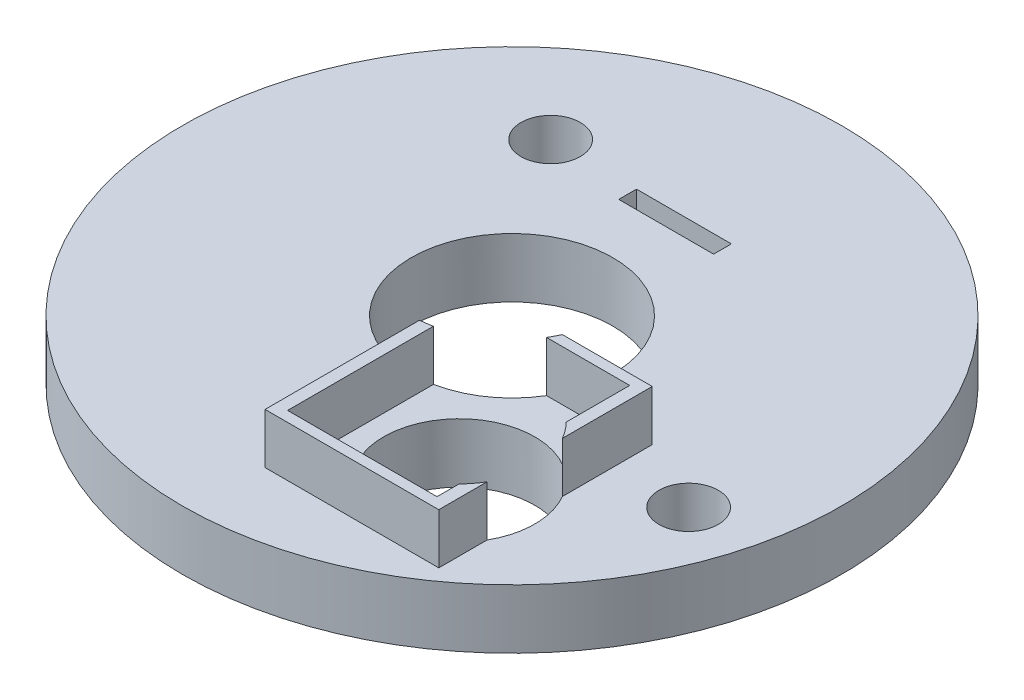
from build123d import *

# Parameters (mm, degrees)
SKETCH1_R               = 55.585
SKETCH1_R_2             = 17
BOSS_EXTRUDE1_DEPTH     = 10
SKETCH2_W               = 29.3
SKETCH2_H               = 36
SKETCH2_W_2             = 25.2
SKETCH2_H_2             = 32.5
BOSS_EXTRUDE2_DEPTH     = 8.5
CUT_EXTRUDE1_DEPTH      = 10
CUT_EXTRUDE1_DEPTH_BACK = 10
SKETCH4_R               = 12.75
CUT_EXTRUDE2_START      = 10
SKETCH5_R               = 17
CUT_EXTRUDE2_DEPTH      = 10
SKETCH6_R               = 5
CUT_EXTRUDE3_DEPTH      = 10
SKETCH8_R               = 5
SKETCH8_W               = 16
SKETCH8_H               = 3
CUT_EXTRUDE4_DEPTH      = 10


with BuildPart() as part:
    # Sketch1 → Boss-Extrude1 (new body)
    with BuildSketch(Plane(origin=(0, 0, 0), x_dir=(1, 0, 0), z_dir=(0, 1, 0))):
        with Locations(Location((0, 0, 0), (0, 0, 270))):
            Circle(SKETCH1_R)
        with Locations(Location((0, 0, 0), (0, 0, 270))):
            Circle(SKETCH1_R_2, mode=Mode.SUBTRACT)
    extrude(amount=-BOSS_EXTRUDE1_DEPTH)

    # Sketch2 → Boss-Extrude2 (add)
    with BuildSketch(Plane(origin=(0, 0, 0), x_dir=(1, 0, 0), z_dir=(0, 1, 0))):
        with Locations((16, -25)):
            Rectangle(SKETCH2_W, SKETCH2_H)
        with Locations((16, -25)):
            Rectangle(SKETCH2_W_2, SKETCH2_H_2, mode=Mode.SUBTRACT)
    extrude(amount=BOSS_EXTRUDE2_DEPTH)

    # Sketch4 → Cut-Extrude1 (cut, two sides: drawn at the far end of the back side and taken through both)
    with BuildSketch(Plane(origin=(0, 0, 0), x_dir=(1, 0, 0), z_dir=(0, 1, 0)).offset(-CUT_EXTRUDE1_DEPTH_BACK)):
        with Locations(Location((19.6, -28.5, 0), (0, 0, 270))):
            Circle(SKETCH4_R)
    extrude(amount=CUT_EXTRUDE1_DEPTH + CUT_EXTRUDE1_DEPTH_BACK, mode=Mode.SUBTRACT)

    # Sketch5 → Cut-Extrude2 (cut)
    with BuildSketch(Plane(origin=(0, 0, 0), x_dir=(1, 0, 0), z_dir=(0, 1, 0)).offset(CUT_EXTRUDE2_START)):
        with Locations(Location((0, 0, 0), (0, 0, 270))):
            Circle(SKETCH5_R)
    extrude(amount=-CUT_EXTRUDE2_DEPTH, mode=Mode.SUBTRACT)

    # Sketch6 → Cut-Extrude3 (cut)
    with BuildSketch(Plane(origin=(0, 0, 0), x_dir=(1, 0, 0), z_dir=(0, 1, 0))):
        with Locations(Location((42.877793379, -13.088165395, 0), (0, 0, 270))):
            Circle(SKETCH6_R)
    extrude(amount=-CUT_EXTRUDE3_DEPTH, mode=Mode.SUBTRACT)

    # Sketch8 → Cut-Extrude4 (cut)
    with BuildSketch(Plane(origin=(0, 0, 0), x_dir=(1, 0, 0), z_dir=(0, 1, 0))):
        with Locations(Location((-22.482738101, 29, 0), (0, 0, 270))):
            Circle(SKETCH8_R)
        with Locations((0, 27.5)):
            Rectangle(SKETCH8_W, SKETCH8_H)
    extrude(amount=-CUT_EXTRUDE4_DEPTH, mode=Mode.SUBTRACT)


solid = part.part
